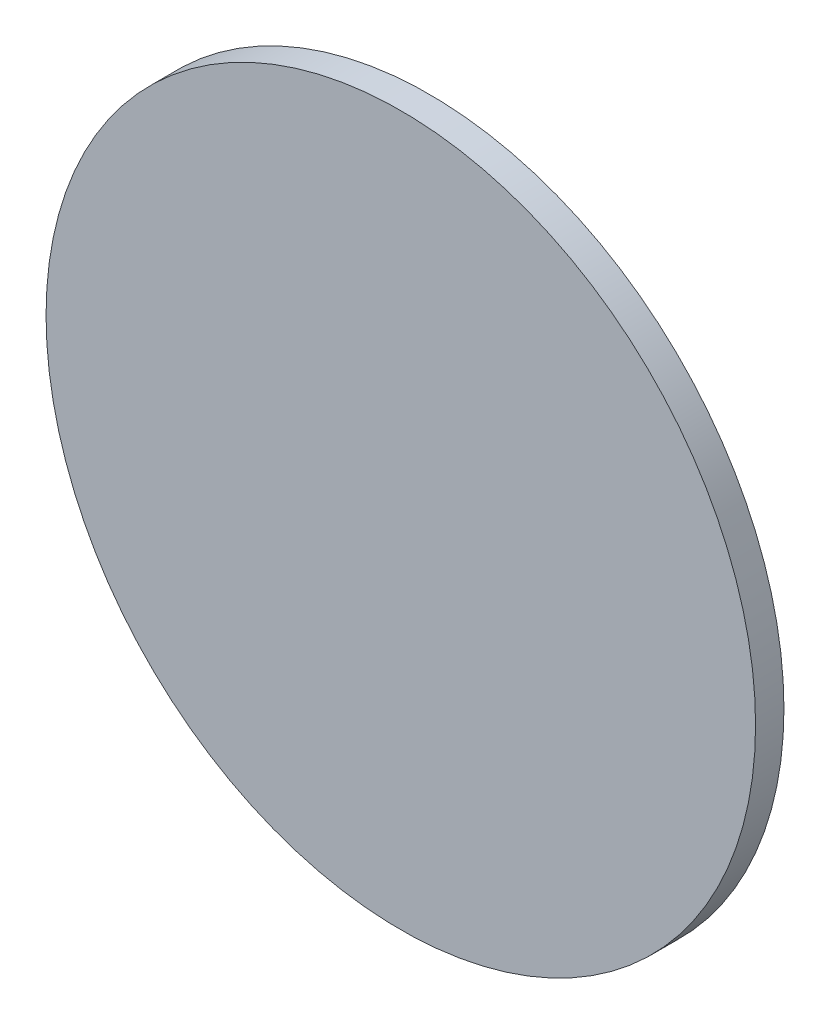
from build123d import *

# Parameters (mm, degrees)
SKETCH_1_R          = 50
EXTRUDE_1_DEPTH     = 4
SKETCH_2_W          = 8
SKETCH_2_H          = 1.2
CUT_EXTRUDE_1_DEPTH = 0.2
SKETCH_4_R          = 47
SKETCH_4_R_2        = 45
CUT_EXTRUDE_2_DEPTH = 0.2
CUT_EXTRUDE_3_DEPTH = 0.2


with BuildPart() as part:
    # Эскиз1 → Бобышка-Вытянуть1 (new body)
    with BuildSketch(Plane.XY):
        Circle(SKETCH_1_R)
    extrude(amount=EXTRUDE_1_DEPTH)

    # Эскиз2 → Вырез-Вытянуть1 (cut)
    with BuildSketch(Plane(origin=(0, 0, 0), x_dir=(-1, 0, 0), z_dir=(0, 0, -1))):
        with BuildLine():
            ThreePointArc((9.6, -21.553620723), (9.034314575, -21.319306148), (8.8, -20.753620723))
            Line((8.8, -20.753620723), (8.8, -14.353620723))
            ThreePointArc((8.8, -14.353620723), (9.034314575, -13.787935298), (9.6, -13.553620723))
            Line((9.6, -13.553620723), (14.4, -13.553620723))
            ThreePointArc((14.4, -13.553620723), (14.965685425, -13.787935298), (15.2, -14.353620723))
            Line((15.2, -14.353620723), (15.2, -20.753620723))
            ThreePointArc((15.2, -20.753620723), (14.965685425, -21.319306148), (14.4, -21.553620723))
            Line((14.4, -21.553620723), (9.6, -21.553620723))
        make_face()
        with BuildLine():
            ThreePointArc((8, -21.153620723), (7.297056275, -22.850676998), (5.6, -23.553620723))
            Line((5.6, -23.553620723), (-5.6, -23.553620723))
            ThreePointArc((-5.6, -23.553620723), (-7.297056275, -22.850676998), (-8, -21.153620723))
            Line((-8, -21.153620723), (-8, -13.953620723))
            ThreePointArc((-8, -13.953620723), (-7.297056275, -12.256564449), (-5.6, -11.553620723))
            Line((-5.6, -11.553620723), (5.6, -11.553620723))
            ThreePointArc((5.6, -11.553620723), (7.297056275, -12.256564449), (8, -13.953620723))
            Line((8, -13.953620723), (8, -21.153620723))
        make_face()
        with BuildLine():
            Line((-14.4, -21.553620723), (-9.6, -21.553620723))
            ThreePointArc((-9.6, -21.553620723), (-9.034314575, -21.319306148), (-8.8, -20.753620723))
            Line((-8.8, -20.753620723), (-8.8, -14.353620723))
            ThreePointArc((-8.8, -14.353620723), (-9.034314575, -13.787935298), (-9.6, -13.553620723))
            Line((-9.6, -13.553620723), (-14.4, -13.553620723))
            ThreePointArc((-14.4, -13.553620723), (-14.965685425, -13.787935298), (-15.2, -14.353620723))
            Line((-15.2, -14.353620723), (-15.2, -20.753620723))
            ThreePointArc((-15.2, -20.753620723), (-14.965685425, -21.319306148), (-14.4, -21.553620723))
        make_face()
        with BuildLine():
            ThreePointArc((20, -30.753620723), (19.765685425, -31.319306148), (19.2, -31.553620723))
            Line((19.2, -31.553620723), (16.8, -31.553620723))
            ThreePointArc((16.8, -31.553620723), (16.234314575, -31.319306148), (16, -30.753620723))
            Line((16, -30.753620723), (16, -4.353620723))
            ThreePointArc((16, -4.353620723), (16.234314575, -3.787935298), (16.8, -3.553620723))
            Line((16.8, -3.553620723), (19.2, -3.553620723))
            ThreePointArc((19.2, -3.553620723), (19.765685425, -3.787935298), (20, -4.353620723))
            Line((20, -4.353620723), (20, -30.753620723))
        make_face()
        with BuildLine():
            Line((-19.2, -31.553620723), (-16.8, -31.553620723))
            ThreePointArc((-16.8, -31.553620723), (-16.234314575, -31.319306148), (-16, -30.753620723))
            Line((-16, -30.753620723), (-16, -4.353620723))
            ThreePointArc((-16, -4.353620723), (-16.234314575, -3.787935298), (-16.8, -3.553620723))
            Line((-16.8, -3.553620723), (-19.2, -3.553620723))
            ThreePointArc((-19.2, -3.553620723), (-19.765685425, -3.787935298), (-20, -4.353620723))
            Line((-20, -4.353620723), (-20, -30.753620723))
            ThreePointArc((-20, -30.753620723), (-19.765685425, -31.319306148), (-19.2, -31.553620723))
        make_face()
        with Locations((-19.32820323, -34.353620723)):
            Rectangle(SKETCH_2_W, SKETCH_2_H)
        with BuildLine():
            Line((-2.8, -29.953620723), (-6.692820323, -29.953620723))
            ThreePointArc((-6.692820323, -29.953620723), (-6.899875559, -29.980880062), (-7.092820323, -30.0608004))
            Line((-7.092820323, -30.0608004), (-13.649742261, -33.846441046))
            ThreePointArc((-13.649742261, -33.846441046), (-13.842687025, -33.926361384), (-14.049742261, -33.953620723))
            Line((-14.049742261, -33.953620723), (-14.52820323, -33.953620723))
            Line((-14.52820323, -33.953620723), (-14.52820323, -34.753620723))
            Line((-14.52820323, -34.753620723), (-13.835382907, -34.753620723))
            ThreePointArc((-13.835382907, -34.753620723), (-13.628327671, -34.726361384), (-13.435382907, -34.646441046))
            Line((-13.435382907, -34.646441046), (-6.878460969, -30.8608004))
            ThreePointArc((-6.878460969, -30.8608004), (-6.685516205, -30.780880062), (-6.478460969, -30.753620723))
            Line((-6.478460969, -30.753620723), (-2.8, -30.753620723))
            Line((-2.8, -30.753620723), (-2.8, -29.953620723))
        make_face()
        with BuildLine():
            Line((1.2, -28.353620723), (-1.2, -28.353620723))
            ThreePointArc((-1.2, -28.353620723), (-1.765685425, -28.119306148), (-2, -27.553620723))
            Line((-2, -27.553620723), (-2, -25.153620723))
            ThreePointArc((-2, -25.153620723), (-1.765685425, -24.587935298), (-1.2, -24.353620723))
            Line((-1.2, -24.353620723), (1.2, -24.353620723))
            ThreePointArc((1.2, -24.353620723), (1.765685425, -24.587935298), (2, -25.153620723))
            Line((2, -25.153620723), (2, -27.553620723))
            ThreePointArc((2, -27.553620723), (1.765685425, -28.119306148), (1.2, -28.353620723))
        make_face()
        with BuildLine():
            Line((2, -30.753620723), (2, -29.953620723))
            ThreePointArc((2, -29.953620723), (1.765685425, -29.387935298), (1.2, -29.153620723))
            Line((1.2, -29.153620723), (-1.2, -29.153620723))
            ThreePointArc((-1.2, -29.153620723), (-1.765685425, -29.387935298), (-2, -29.953620723))
            Line((-2, -29.953620723), (-2, -30.753620723))
            ThreePointArc((-2, -30.753620723), (-1.765685425, -31.319306148), (-1.2, -31.553620723))
            Line((-1.2, -31.553620723), (1.2, -31.553620723))
            ThreePointArc((1.2, -31.553620723), (1.765685425, -31.319306148), (2, -30.753620723))
        make_face()
    extrude(amount=-CUT_EXTRUDE_1_DEPTH, mode=Mode.SUBTRACT)

    # Эскиз4 → Вырез-Вытянуть2 (cut)
    with BuildSketch(Plane(origin=(0, 0, 0), x_dir=(-1, 0, 0), z_dir=(0, 0, -1))):
        Circle(SKETCH_4_R)
        Circle(SKETCH_4_R_2, mode=Mode.SUBTRACT)
    extrude(amount=-CUT_EXTRUDE_2_DEPTH, mode=Mode.SUBTRACT)

    # Эскиз3 → Вырез-Вытянуть3 (cut)
    # profile 1 of 6: a face of its own
    with BuildSketch(Plane(origin=(0, 0, 0), x_dir=(-1, 0, 0), z_dir=(0, 0, -1))):
        with BuildLine():
            Line((35.551948052, 5), (30.115665584, 5))
            add(Edge.make_bspline(
                [(30.115665584, 5), (29.937091199, 5.001473183), (29.594079556, 5.004302922), (29.099605328, 5.017255788), (28.646003666, 5.048879689), (28.232913376, 5.088069238), (27.8603329, 5.133494877), (27.530779012, 5.199253281), (27.240831208, 5.269163249), (26.911127268, 5.383088136), (26.539984977, 5.567794283), (26.137493967, 5.858051577), (25.772017537, 6.217316874), (25.446069012, 6.636494944), (25.175873122, 7.107978869), (24.97958181, 7.617774193), (24.859781445, 8.159050619), (24.845133891, 8.530228176), (24.837662338, 8.719561688)],
                knots=[0, 0, 0, 0, 1.160381862, 2.228900238, 3.213415365, 4.114103045, 4.925294118, 5.650635778, 6.296614867, 6.861624855, 7.914180689, 8.977152731, 10.072743779, 11.233219277, 12.417275193, 13.590174699, 14.77077512, 16, 16, 16, 16], degree=3))
            add(Edge.make_bspline(
                [(24.837662338, 8.719561688), (24.842647517, 8.893599431), (24.852467098, 9.236411136), (24.955963091, 9.734751594), (25.108884238, 10.210860094), (25.332586557, 10.650710622), (25.600864199, 11.053288016), (25.914344911, 11.401072899), (26.259080137, 11.702651391), (26.521063337, 11.850795895), (26.651785714, 11.924715909)],
                knots=[0, 0, 0, 0, 1.078180514, 2.123751403, 3.14486066, 4.172313472, 5.174388341, 6.137245694, 7.070537081, 8, 8, 8, 8], degree=3))
            add(Edge.make_bspline(
                [(26.651785714, 11.924715909), (26.55985712, 11.958737728), (26.378088979, 12.026008231), (26.118687099, 12.151928699), (25.875127415, 12.295471165), (25.645251363, 12.453989457), (25.43140231, 12.630228377), (25.235815901, 12.82775416), (25.05365377, 13.040302335), (24.884777399, 13.269007954), (24.736552013, 13.5148041), (24.608680358, 13.775037634), (24.499061847, 14.046730326), (24.406574127, 14.331047301), (24.33704581, 14.629491967), (24.289711169, 14.940988073), (24.257389074, 15.264133298), (24.254642623, 15.483887393), (24.253246753, 15.595576299)],
                knots=[0, 0, 0, 0, 0.999889917, 1.977057642, 2.93779377, 3.882777214, 4.824066083, 5.761245497, 6.71588023, 7.678901374, 8.659136449, 9.640847001, 10.634929807, 11.646757859, 12.689067584, 13.758138146, 14.860585063, 16, 16, 16, 16], degree=3))
            add(Edge.make_bspline(
                [(24.253246753, 15.595576299), (24.254887974, 15.731673272), (24.258105576, 15.998490391), (24.30397586, 16.389790562), (24.369169849, 16.765610977), (24.463437998, 17.125179497), (24.585602756, 17.468444314), (24.736084005, 17.794347596), (24.908908893, 18.107956179), (25.113167372, 18.399861489), (25.332640928, 18.670838797), (25.563370827, 18.917162304), (25.802224418, 19.138130365), (26.057141275, 19.325124909), (26.316423537, 19.492790718), (26.5875718, 19.62989811), (26.86974194, 19.737220403), (27.063209862, 19.788595708), (27.160105519, 19.814326299)],
                knots=[0, 0, 0, 0, 1.181932189, 2.317169401, 3.418803919, 4.494448454, 5.542977533, 6.58055192, 7.610720739, 8.650091533, 9.671774592, 10.638575163, 11.58094735, 12.494334548, 13.382174628, 14.261437192, 15.129265542, 16, 16, 16, 16], degree=3))
            add(Edge.make_bspline(
                [(27.160105519, 19.814326299), (27.239123837, 19.829257361), (27.419682195, 19.863375124), (27.726485857, 19.901608476), (28.101453075, 19.928899854), (28.542673303, 19.958379806), (29.051301734, 19.973296627), (29.627545582, 19.989924121), (30.271892468, 19.998335425), (30.724430598, 19.999427207), (30.961850649, 20)],
                knots=[0, 0, 0, 0, 0.506382565, 1.157093793, 1.945653561, 2.8739825, 3.941796261, 5.14992342, 6.504733011, 8, 8, 8, 8], degree=3))
            Line((30.961850649, 20), (35.551948052, 20))
            Line((35.551948052, 20), (35.551948052, 5))
        make_face()
        with BuildLine():
            Line((32.824675325, 7.532467532), (32.824675325, 10.844155844))
            Line((32.824675325, 10.844155844), (30.967938312, 10.844155844))
            add(Edge.make_bspline(
                [(30.967938312, 10.844155844), (30.835022318, 10.844507427), (30.583390758, 10.845173031), (30.225249752, 10.840739594), (29.90762932, 10.839463804), (29.628663889, 10.831796832), (29.390109243, 10.827743194), (29.191356277, 10.817074289), (29.032782735, 10.810271768), (28.940715056, 10.799906059), (28.901176948, 10.795454545)],
                knots=[0, 0, 0, 0, 1.542499901, 2.920202804, 4.156613756, 5.228380076, 6.158887989, 6.925065281, 7.538373446, 8, 8, 8, 8], degree=3))
            add(Edge.make_bspline(
                [(28.901176948, 10.795454545), (28.786744153, 10.77544297), (28.56816189, 10.737218129), (28.262349513, 10.628491492), (27.995088532, 10.480170791), (27.769198808, 10.289137801), (27.588652219, 10.059877738), (27.458584563, 9.79153118), (27.381829369, 9.484733018), (27.374139967, 9.267906608), (27.37012987, 9.154829545)],
                knots=[0, 0, 0, 0, 1.119375272, 2.138159598, 3.115702119, 4.053358632, 4.973838323, 5.910830176, 6.910477801, 8, 8, 8, 8], degree=3))
            add(Edge.make_bspline(
                [(27.37012987, 9.154829545), (27.374029389, 9.053033751), (27.381477347, 8.858606996), (27.443270567, 8.58123678), (27.546983258, 8.334275638), (27.691774703, 8.120175205), (27.864554634, 7.940611504), (28.060413808, 7.798528979), (28.271192023, 7.690345195), (28.4699363, 7.630321759), (28.663482578, 7.606078363), (28.863134435, 7.583311846), (29.118304729, 7.571596975), (29.427560592, 7.553760588), (29.793042287, 7.548148023), (30.212999822, 7.53619502), (30.687916031, 7.535984809), (31.02273101, 7.533681829), (31.199269481, 7.532467532)],
                knots=[0, 0, 0, 0, 1.0245094, 1.956780637, 2.845164168, 3.706869502, 4.545290326, 5.342522497, 6.133242783, 6.922243966, 7.417997122, 8.096305968, 8.94611083, 9.98981125, 11.21660469, 12.627309698, 14.221675775, 16, 16, 16, 16], degree=3))
            Line((31.199269481, 7.532467532), (32.824675325, 7.532467532))
        make_face(mode=Mode.SUBTRACT)
        with BuildLine():
            Line((32.824675325, 13.376623377), (32.824675325, 17.467532468))
            Line((32.824675325, 17.467532468), (30.267857143, 17.467532468))
            add(Edge.make_bspline(
                [(30.267857143, 17.467532468), (30.13392834, 17.466693137), (29.878232666, 17.465090693), (29.513904378, 17.460076409), (29.187119349, 17.447981481), (28.897750324, 17.430660847), (28.64616956, 17.40581929), (28.431491443, 17.380195415), (28.255721351, 17.347129637), (28.071003441, 17.300249395), (27.874030479, 17.211311394), (27.66218737, 17.069255999), (27.467190036, 16.889401931), (27.29508133, 16.671761925), (27.153115465, 16.416558306), (27.054070301, 16.126988551), (26.991910087, 15.806195672), (26.984421419, 15.581676388), (26.980519481, 15.464691558)],
                knots=[0, 0, 0, 0, 1.434999095, 2.739687462, 3.90368554, 4.938478103, 5.844943747, 6.612170087, 7.253921192, 7.760206133, 8.650956279, 9.552454234, 10.483360762, 11.481649758, 12.513239684, 13.596244758, 14.747533437, 16, 16, 16, 16], degree=3))
            add(Edge.make_bspline(
                [(26.980519481, 15.464691558), (26.983803071, 15.344554222), (26.990121104, 15.113395156), (27.060946468, 14.784103043), (27.163731402, 14.484398894), (27.319094306, 14.223189556), (27.509434165, 14.000015583), (27.727969698, 13.811659827), (27.97418554, 13.660621449), (28.205545281, 13.567407963), (28.419668323, 13.511261182), (28.620595738, 13.477613253), (28.858703203, 13.441993421), (29.134430663, 13.421622888), (29.44668533, 13.397417335), (29.796050067, 13.38867204), (30.183576968, 13.377729381), (30.454533466, 13.37700379), (30.596590909, 13.376623377)],
                knots=[0, 0, 0, 0, 1.193446668, 2.29633872, 3.337472445, 4.333113948, 5.300085914, 6.245146849, 7.192308699, 8.161597021, 8.715049612, 9.392323674, 10.18762019, 11.109918382, 12.142153575, 13.303919353, 14.586495156, 16, 16, 16, 16], degree=3))
            Line((30.596590909, 13.376623377), (32.824675325, 13.376623377))
        make_face(mode=Mode.SUBTRACT)
    # profile 2 of 6: a face of its own
    with BuildSketch(Plane(origin=(0, 0, 0), x_dir=(-1, 0, 0), z_dir=(0, 0, -1))):
        with BuildLine():
            Line((22.11038961, 20), (22.11038961, 5))
            Line((22.11038961, 5), (16.439732143, 5))
            add(Edge.make_bspline(
                [(16.439732143, 5), (16.265211698, 5.001210599), (15.928243527, 5.003548051), (15.441834783, 5.020142309), (14.994457305, 5.055440547), (14.585714589, 5.094985672), (14.217048728, 5.153127539), (13.886614877, 5.222486817), (13.594155214, 5.303162262), (13.256366346, 5.427728849), (12.878297311, 5.635511825), (12.468841077, 5.952288329), (12.103070166, 6.345412904), (11.84163457, 6.72725524), (11.65715921, 7.062829247), (11.535309705, 7.331564082), (11.431374021, 7.613244524), (11.345990497, 7.907066121), (11.283840106, 8.213898188), (11.233037126, 8.531433082), (11.206750974, 8.862171289), (11.203130674, 9.086812378), (11.201298701, 9.200487013)],
                knots=[0, 0, 0, 0, 1.349751095, 2.606131096, 3.762844442, 4.820046804, 5.781150979, 6.64761627, 7.43014137, 8.125374904, 9.427977236, 10.747976699, 12.113645915, 13.563277574, 14.314775707, 15.073287432, 15.842919968, 16.635141963, 17.436943586, 18.26261818, 19.120836503, 20, 20, 20, 20], degree=3))
            add(Edge.make_bspline(
                [(11.201298701, 9.200487013), (11.204279444, 9.343663684), (11.210106578, 9.623563647), (11.253874524, 10.032477084), (11.322051277, 10.420887864), (11.423483407, 10.787181896), (11.550436141, 11.132037035), (11.707133569, 11.455471804), (11.893418287, 11.756743798), (12.106058228, 12.038503958), (12.349107342, 12.292969374), (12.610174905, 12.530816521), (12.900654001, 12.736757328), (13.214569839, 12.91674901), (13.549313204, 13.076645611), (13.910896914, 13.206010025), (14.295296891, 13.313963569), (14.562235882, 13.363488126), (14.698660714, 13.388798701)],
                knots=[0, 0, 0, 0, 1.140890719, 2.230358243, 3.274028907, 4.280412938, 5.25524473, 6.199167015, 7.139480173, 8.074283567, 9.006740714, 9.940179099, 10.884897695, 11.837748685, 12.821627446, 13.837195892, 14.894653098, 16, 16, 16, 16], degree=3))
            add(Edge.make_bspline(
                [(14.698660714, 13.388798701), (14.558219721, 13.483195075), (14.284112912, 13.667433939), (13.905966963, 13.971232085), (13.562566709, 14.284815785), (13.301311639, 14.565767079), (13.101279117, 14.81424968), (12.944127971, 15.035239966), (12.772416277, 15.287576479), (12.594820809, 15.577796445), (12.402738661, 15.90029187), (12.199461632, 16.256850359), (11.981963712, 16.646231727), (11.838802482, 16.920287425), (11.764407468, 17.062702922)],
                knots=[0, 0, 0, 0, 1.277014655, 2.492423366, 3.657954799, 4.785385036, 5.384716416, 6.065021639, 6.831963681, 7.688566633, 8.633091871, 9.665837592, 10.787031605, 12, 12, 12, 12], degree=3))
            Line((11.764407468, 17.062702922), (10.227272727, 20))
            Line((10.227272727, 20), (13.468952922, 20))
            Line((13.468952922, 20), (15.325689935, 16.724837662))
            add(Edge.make_bspline(
                [(15.325689935, 16.724837662), (15.405413649, 16.583558171), (15.557318478, 16.314365536), (15.780294408, 15.93491461), (15.979872011, 15.595607286), (16.164139704, 15.300955542), (16.323358045, 15.044224286), (16.466902552, 14.832079958), (16.587127917, 14.659513026), (16.723271665, 14.491978301), (16.882287343, 14.322581229), (17.081410804, 14.160292093), (17.279424634, 14.020769172), (17.497454789, 13.918712087), (17.751329515, 13.848305879), (18.057328777, 13.798713348), (18.425791512, 13.769860911), (18.692112295, 13.767501606), (18.835227273, 13.766233766)],
                knots=[0, 0, 0, 0, 1.570868018, 2.993117396, 4.261940993, 5.382576141, 6.35844358, 7.186855882, 7.863013787, 8.393939438, 9.276515492, 10.106790182, 10.87799172, 11.616388216, 12.424807411, 13.421425731, 14.614330448, 16, 16, 16, 16], degree=3))
            Line((18.835227273, 13.766233766), (19.383116883, 13.766233766))
            Line((19.383116883, 13.766233766), (19.383116883, 20))
            Line((19.383116883, 20), (22.11038961, 20))
        make_face()
        with BuildLine():
            Line((19.383116883, 11.233766234), (17.383319805, 11.233766234))
            add(Edge.make_bspline(
                [(17.383319805, 11.233766234), (17.237217162, 11.232898912), (16.959203872, 11.231248518), (16.563410296, 11.226621396), (16.209352088, 11.213220728), (15.896606266, 11.200056262), (15.625762616, 11.177844591), (15.395943674, 11.15539182), (15.208074548, 11.125214757), (15.013801693, 11.08323438), (14.810814492, 11.00288969), (14.592115302, 10.877034362), (14.39917148, 10.709931838), (14.231753451, 10.507615776), (14.089535579, 10.270778542), (14.000789433, 9.991535036), (13.935208737, 9.680391725), (13.930858642, 9.459623565), (13.928571429, 9.343547078)],
                knots=[0, 0, 0, 0, 1.530902659, 2.913097779, 4.147028141, 5.243311801, 6.192393883, 6.994242862, 7.661883965, 8.185400599, 9.073837787, 9.936261241, 10.818379041, 11.73171849, 12.679847438, 13.691805882, 14.786387198, 16, 16, 16, 16], degree=3))
            add(Edge.make_bspline(
                [(13.928571429, 9.343547078), (13.930894255, 9.232534051), (13.935324476, 9.020804009), (14.001029974, 8.721776819), (14.090396506, 8.45189896), (14.231699404, 8.22092807), (14.403450067, 8.02396597), (14.605216273, 7.861415774), (14.831506686, 7.726285833), (14.999683734, 7.670447644), (15.085227273, 7.642045455)],
                knots=[0, 0, 0, 0, 1.194489331, 2.27819457, 3.288780672, 4.245819423, 5.176344356, 6.094042784, 7.030531653, 8, 8, 8, 8], degree=3))
            add(Edge.make_bspline(
                [(15.085227273, 7.642045455), (15.123705839, 7.633540921), (15.215295593, 7.613297752), (15.37679091, 7.5895596), (15.584229173, 7.573348969), (15.835901493, 7.558182506), (16.132236111, 7.546661888), (16.473149341, 7.536658456), (16.85877306, 7.53585194), (17.130684431, 7.533634282), (17.273741883, 7.532467532)],
                knots=[0, 0, 0, 0, 0.430892152, 1.025643899, 1.783105936, 2.70574662, 3.782977, 5.026178935, 6.435419374, 8, 8, 8, 8], degree=3))
            Line((17.273741883, 7.532467532), (19.383116883, 7.532467532))
            Line((19.383116883, 7.532467532), (19.383116883, 11.233766234))
        make_face(mode=Mode.SUBTRACT)
    # profile 3 of 6: a face of its own
    with BuildSketch(Plane(origin=(0, 0, 0), x_dir=(-1, 0, 0), z_dir=(0, 0, -1))):
        Polygon((8.668831169, 20), (8.668831169, 5), (-1.266233766, 5), (-1.266233766, 7.532467532), (5.941558442, 7.532467532), (5.941558442, 11.038961039), (-0.876623377, 11.038961039), (-0.876623377, 13.376623377), (5.941558442, 13.376623377), (5.941558442, 17.467532468), (-1.461038961, 17.467532468), (-1.461038961, 20), align=None)
    # profile 4 of 6: a face of its own
    with BuildSketch(Plane(origin=(0, 0, 0), x_dir=(-1, 0, 0), z_dir=(0, 0, -1))):
        Polygon((-3.798701299, 20), (-3.798701299, 5), (-13.733766234, 5), (-13.733766234, 7.532467532), (-6.525974026, 7.532467532), (-6.525974026, 11.038961039), (-13.344155844, 11.038961039), (-13.344155844, 13.376623377), (-6.525974026, 13.376623377), (-6.525974026, 17.467532468), (-13.928571429, 17.467532468), (-13.928571429, 20), align=None)
    # profile 5 of 6: a face of its own
    with BuildSketch(Plane(origin=(0, 0, 0), x_dir=(-1, 0, 0), z_dir=(0, 0, -1))):
        Polygon((-14.902597403, 20), (-14.902597403, 17.263595779), (-22.171266234, 7.532467532), (-15.681818182, 7.532467532), (-15.681818182, 5), (-25.616883117, 5), (-25.616883117, 7.349837662), (-18.059050325, 17.467532468), (-25.811688312, 17.467532468), (-25.811688312, 20), align=None)
    # profile 6 of 6: a face of its own
    with BuildSketch(Plane(origin=(0, 0, 0), x_dir=(-1, 0, 0), z_dir=(0, 0, -1))):
        Polygon((-27.75974026, 20), (-27.75974026, 5), (-37.694805195, 5), (-37.694805195, 7.532467532), (-30.487012987, 7.532467532), (-30.487012987, 11.038961039), (-37.305194805, 11.038961039), (-37.305194805, 13.376623377), (-30.487012987, 13.376623377), (-30.487012987, 17.467532468), (-37.88961039, 17.467532468), (-37.88961039, 20), align=None)
    extrude(amount=-CUT_EXTRUDE_3_DEPTH, mode=Mode.SUBTRACT)


solid = part.part
